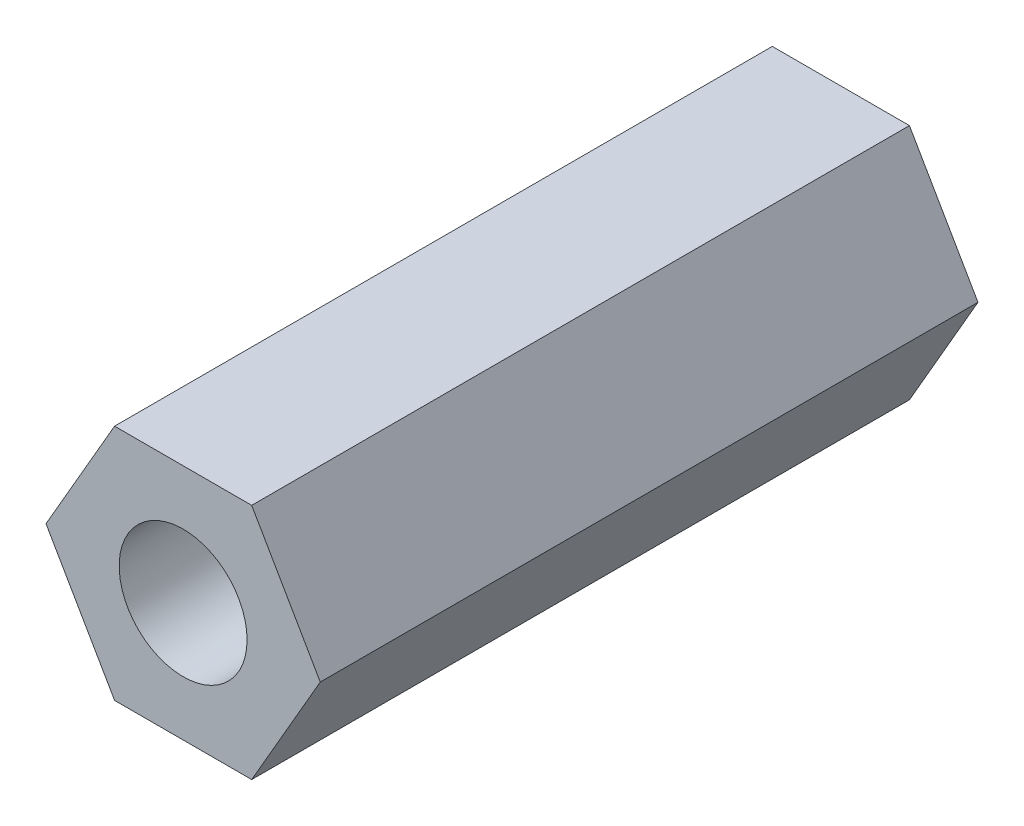
from build123d import *

# Parameters (mm, degrees)
CROQUIS1_R              = 1.75
SALIENTE_EXTRUIR1_DEPTH = 18


with BuildPart() as part:
    # Croquis1 → Saliente-Extruir1 (new body)
    with BuildSketch(Plane.XY):
        Polygon((3.75277675, 0), (1.876388375, 3.25), (-1.876388375, 3.25), (-3.75277675, 0), (-1.876388375, -3.25), (1.876388375, -3.25), align=None)
        Circle(CROQUIS1_R, mode=Mode.SUBTRACT)
    extrude(amount=SALIENTE_EXTRUIR1_DEPTH)


solid = part.part
